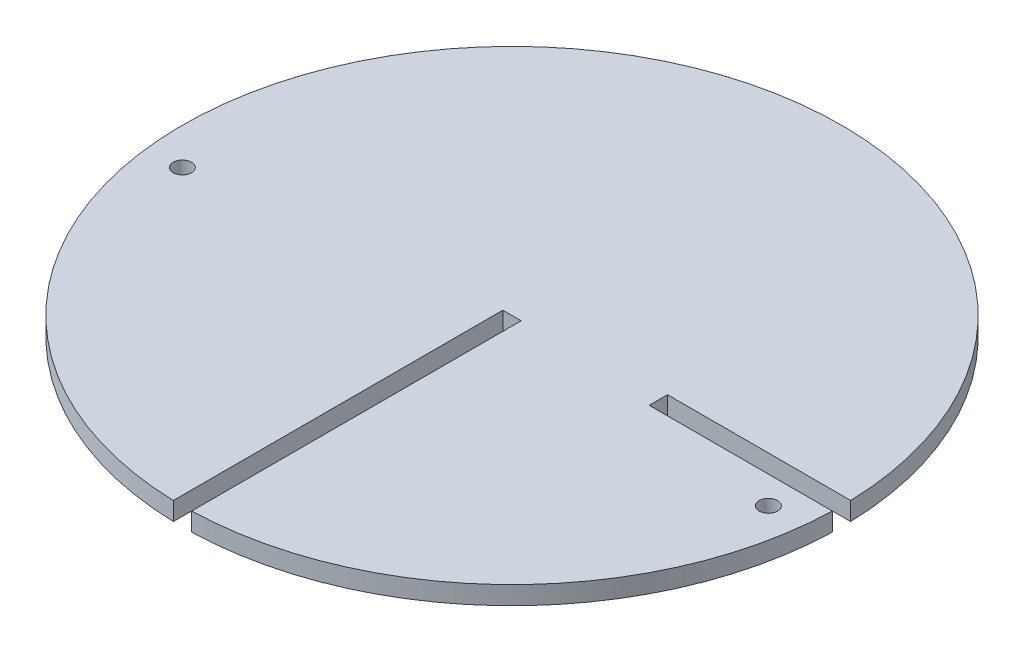
from build123d import *

# Parameters (mm, degrees)
SKETCH1_R           = 114.3
BOSS_EXTRUDE1_DEPTH = 6.35
SKETCH2_W           = 6.35
SKETCH2_H           = 114.3
CUT_EXTRUDE1_DEPTH  = 6.35
CUT_EXTRUDE2_DEPTH  = 162.769287876
SKETCH4_R           = 3.175
CUT_EXTRUDE3_DEPTH  = 162.769287876


with BuildPart() as part:
    # Sketch1 → Boss-Extrude1 (new body)
    with BuildSketch(Plane(origin=(0, 0, 0), x_dir=(1, 0, 0), z_dir=(0, 1, 0))):
        with Locations(Location((0, 0, 0), (0, 0, 270))):
            Circle(SKETCH1_R)
    extrude(amount=BOSS_EXTRUDE1_DEPTH)

    # Sketch2 → Cut-Extrude1 (cut)
    with BuildSketch(Plane(origin=(0, 6.35, 0), x_dir=(1, 0, 0), z_dir=(0, 1, 0))):
        with Locations((0, -57.15)):
            Rectangle(SKETCH2_W, SKETCH2_H)
    extrude(amount=-CUT_EXTRUDE1_DEPTH, mode=Mode.SUBTRACT)

    # Sketch3 → Cut-Extrude2 (cut, through all)
    with BuildSketch(Plane(origin=(0, 6.35, 0), x_dir=(1, 0, 0), z_dir=(0, 1, 0))):
        Polygon((114.255894268, 3.175), (120.605894268, 3.175), (120.605894268, -3.175), (114.255894268, -3.175), (50.755894268, -3.175), (50.755894268, 3.175), align=None)
    extrude(amount=-CUT_EXTRUDE2_DEPTH, mode=Mode.SUBTRACT)

    # Sketch4 → Cut-Extrude3 (cut, through all)
    with BuildSketch(Plane(origin=(0, 6.35, 0), x_dir=(1, 0, 0), z_dir=(0, 1, 0))):
        with Locations(Location((101.6, -12.7, 0), (0, 0, 270))):
            Circle(SKETCH4_R)
        with Locations(Location((-101.6, -12.7, 0), (0, 0, 270))):
            Circle(SKETCH4_R)
    extrude(amount=-CUT_EXTRUDE3_DEPTH, mode=Mode.SUBTRACT)


solid = part.part
